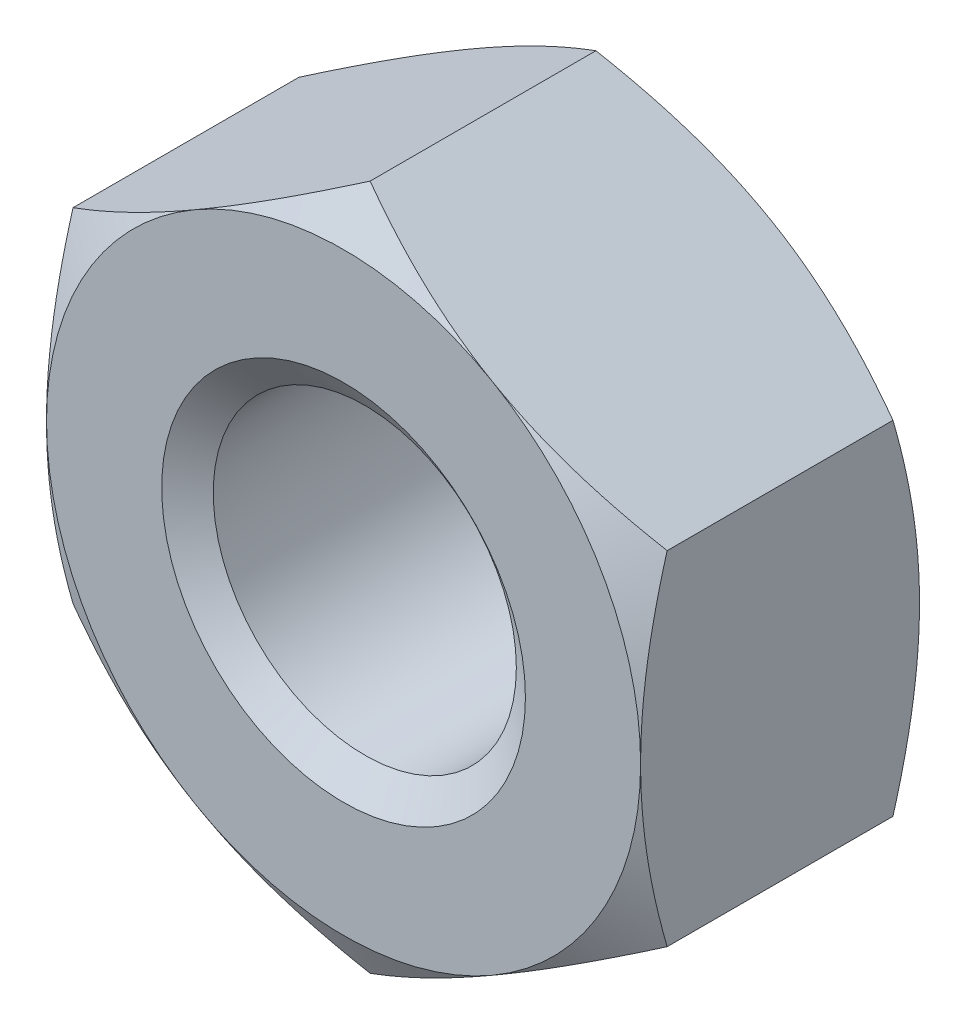
from build123d import *

# Parameters (mm, degrees)
BASENUTSKE_R  = 1.25
BASENUT_DEPTH = 2.3


with BuildPart() as part:
    # BaseNutSke → BaseNut (new body)
    with BuildSketch(Plane.XY):
        Polygon((2.45, 1.41450816), (2.45, -1.41450816), (0, -2.829016319), (-2.45, -1.41450816), (-2.45, 1.41450816), (0, 2.829016319), align=None)
        Circle(BASENUTSKE_R, mode=Mode.SUBTRACT)
    extrude(amount=-BASENUT_DEPTH)

    # Sketch3 → Double-Chamfer (revolve, cut)
    with BuildSketch(Plane(origin=(0, 0, 0), x_dir=(0, 0, -1), z_dir=(1, 0, 0))):
        Polygon((2.3, 2.45), (2.081174826, 2.829016319), (2.081174826, 12.829016319), (12.3, 12.829016319), (12.3, 2.45), align=None)
        Polygon((0.218825174, 12.829016319), (-10, 12.829016319), (-10, 2.45), (0, 2.45), (0.218825174, 2.829016319), align=None)
    revolve(axis=Axis((0, 0, 0), (0, 0, -1)), mode=Mode.SUBTRACT)

    # Sketch5 (on Right Plane) → EndChamfer (revolve, cut)
    with BuildSketch(Plane(origin=(0, 0, 0), x_dir=(0, 0, -1), z_dir=(1, 0, 0)), mode=Mode.PRIVATE) as endchamfer_sk:
        Polygon((2.2746, 1.5), (2.082042927, 1.225), (2.3254, 1.225), (2.3254, 1.5), align=None)
        Polygon((-0.0508, 1.5), (0, 1.5), (0.192557073, 1.225), (-0.0508, 1.225), align=None)
    revolve(endchamfer_sk.sketch.rotate(Axis((0, 0, -25.037505729), (0, 0, -1)), 90), axis=Axis((0, 0, -25.037505729), (0, 0, -1)), mode=Mode.SUBTRACT)


solid = part.part
